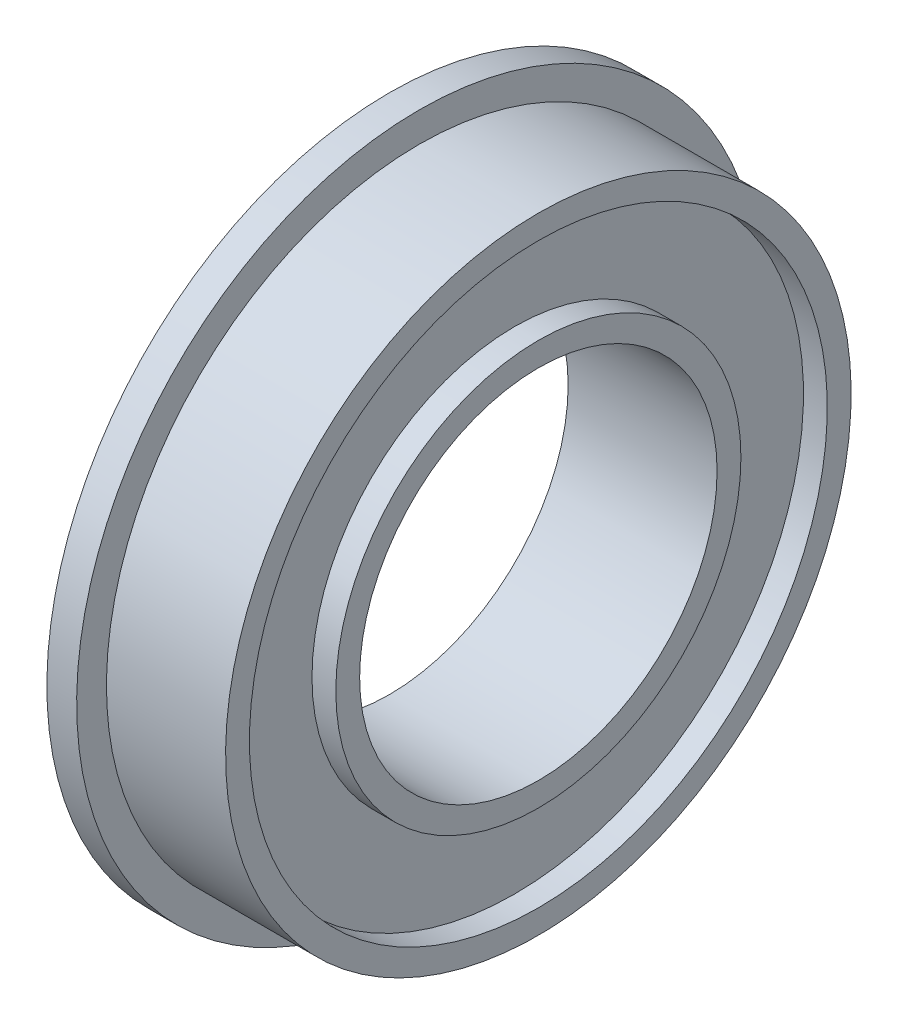
from build123d import *


with BuildPart() as part:
    # 草图1 → 旋转1 (revolve)
    with BuildSketch(Plane.XY):
        Polygon((0, 8.368292683), (1, 8.368292683), (1, 7.368292683), (5, 7.368292683), (5, 6.568292683), (4.2, 6.568292683), (4.2, 3.668292683), (5, 3.668292683), (5, 2.868292683), (0, 2.868292683), (0, 3.668292683), (0.8, 3.668292683), (0.8, 6.568292683), (0, 6.568292683), align=None)
    revolve(axis=Axis((0, -3.131707317, 0), (-1, 0, 0)))


solid = part.part
